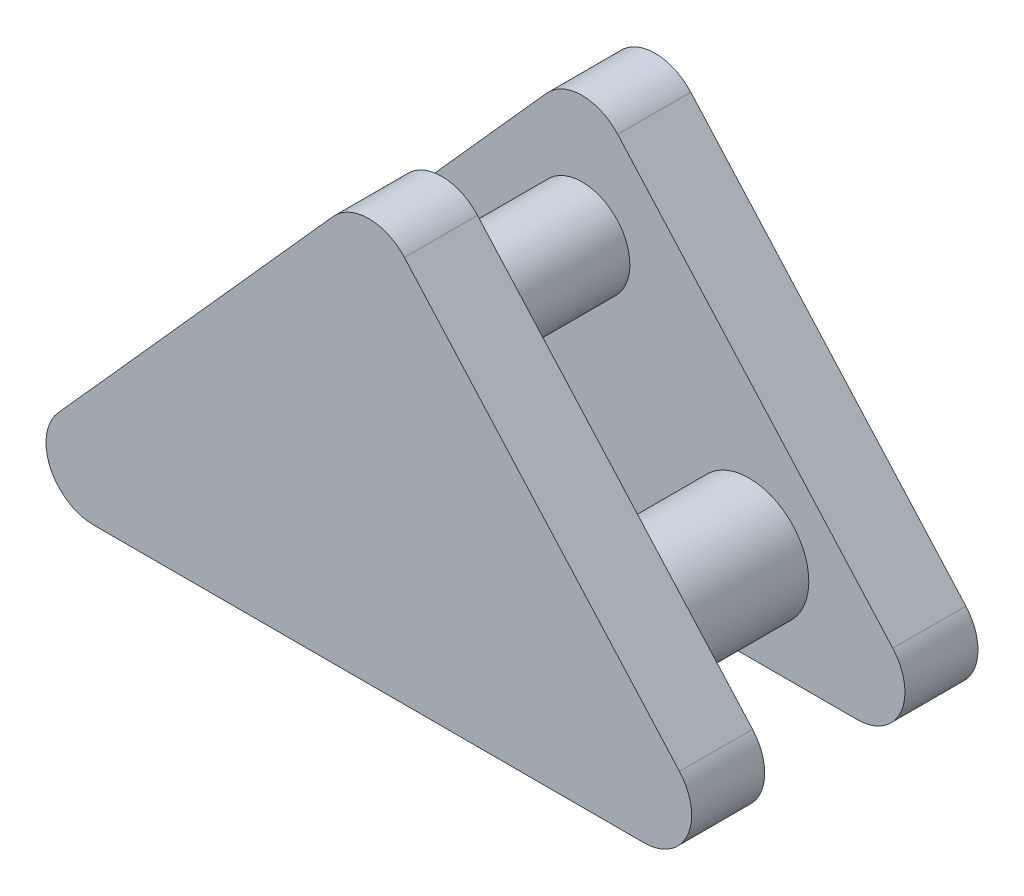
from build123d import *

# Parameters (mm, degrees)
BOSS_EXTRUDE1_DEPTH     = 6
CUT_EXTRUDE1_DEPTH      = 14.416407865
CUT_EXTRUDE1_DEPTH_BACK = 14.416407865
SKETCH2_W               = 2.938755012
SKETCH2_H               = 8.94427191
SKETCH3_R               = 1
SKETCH3_R_2             = 1.25
BOSS_EXTRUDE2_DEPTH     = 6
FILLET1_R               = 1


with BuildPart() as part:
    # Sketch1 → Boss-Extrude1 (new body)
    with BuildSketch(Plane.XY):
        Polygon((-8, 0), (8, 0), (0, 8.94427191), align=None)
    extrude(amount=BOSS_EXTRUDE1_DEPTH)

    # Sketch2 → Cut-Extrude1 (cut, two sides: drawn at the far end of the back side and taken through both)
    with BuildSketch(Plane(origin=(0, 0, 0), x_dir=(0, 0, -1), z_dir=(1, 0, 0)).offset(-CUT_EXTRUDE1_DEPTH_BACK)):
        with Locations((-3, 4.472135955)):
            Rectangle(SKETCH2_W, SKETCH2_H)
    extrude(amount=CUT_EXTRUDE1_DEPTH + CUT_EXTRUDE1_DEPTH_BACK, mode=Mode.SUBTRACT)


with BuildPart() as cut_extrude1_piece_1:
    # of the separate pieces the step leaves, piece 1, a body of its own (cut_extrude1_pieces)
    add(part.part.solids().sort_by_distance((-8, 0, 0))[0])



with BuildPart() as cut_extrude1_piece_2:
    # of the separate pieces the step leaves, piece 2, a body of its own (cut_extrude1_pieces)
    add(part.part.solids().sort_by_distance((-8, 0, 4.469377506))[0])


with BuildPart() as cut_extrude1_piece_1_1:
    add(cut_extrude1_piece_1.part)

    add(cut_extrude1_piece_2.part)  # Boss-Extrude2 merges Cut-Extrude1 piece 2
    # Sketch3 → Boss-Extrude2 (add)
    with BuildSketch(Plane.XY):
        with Locations(Location((0, 5.874639057, 0), (0, 0, 90))):
            Circle(SKETCH3_R)
        with Locations(Location((-3.5, 2, 0), (0, 0, 90))):
            Circle(SKETCH3_R_2)
        with Locations(Location((3.5, 2, 0), (0, 0, 90))):
            Circle(SKETCH3_R_2)
    extrude(amount=BOSS_EXTRUDE2_DEPTH)

    # Fillet1
    fillet1_edges = [cut_extrude1_piece_1_1.edges().sort_by_distance(p)[0] for p in [
        (-8, 0, 5.234688753),
        (8, 0, 0.765311247),
        (-8, 0, 0.765311247),
        (0, 8.94427191, 0.765311247),
        (8, 0, 5.234688753),
        (0, 8.94427191, 5.234688753),
    ]]
    fillet(fillet1_edges, radius=FILLET1_R)


solid = cut_extrude1_piece_1_1.part
